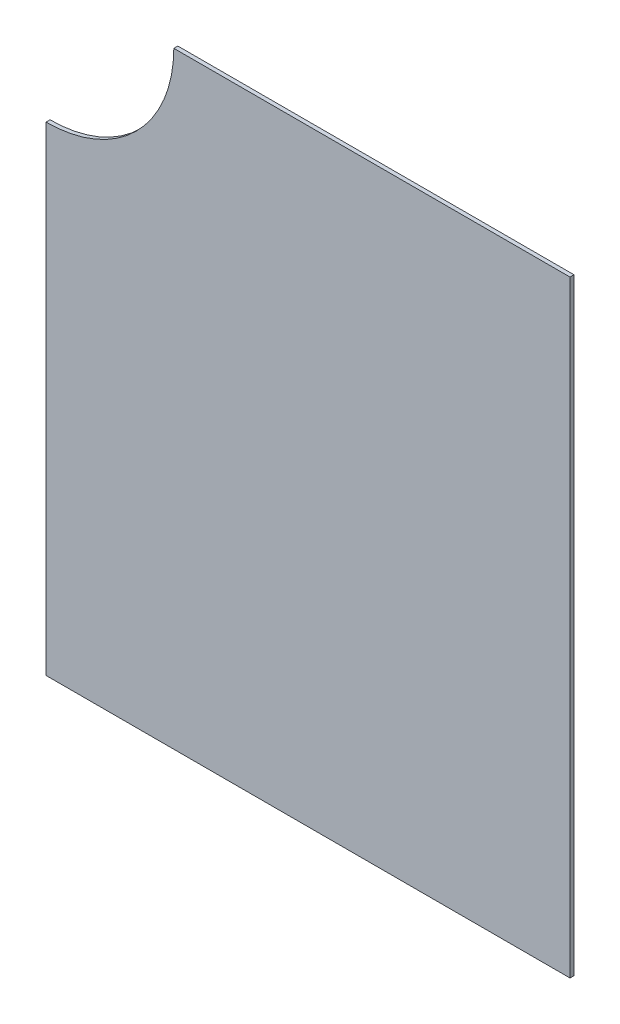
from build123d import *

# Parameters (mm, degrees)
SKETCH2_W           = 25.4
SKETCH2_H           = 241.3
BOSS_EXTRUDE1_DEPTH = 0.79375


with BuildPart() as part:
    # Sketch2 → Boss-Extrude1 (new, symmetric)
    with BuildSketch(Plane.XY):
        with BuildLine():
            ThreePointArc((0, -50.8), (35.921024484, -35.921024484), (50.8, 0))
            Line((50.8, 0), (182.88, 0))
            Line((182.88, 0), (182.88, -241.3))
            Line((182.88, -241.3), (0, -241.3))
            Line((0, -241.3), (0, -50.8))
        make_face()
        with Locations((195.58, -120.65)):
            Rectangle(SKETCH2_W, SKETCH2_H)
    extrude(amount=BOSS_EXTRUDE1_DEPTH, both=True)


solid = part.part
